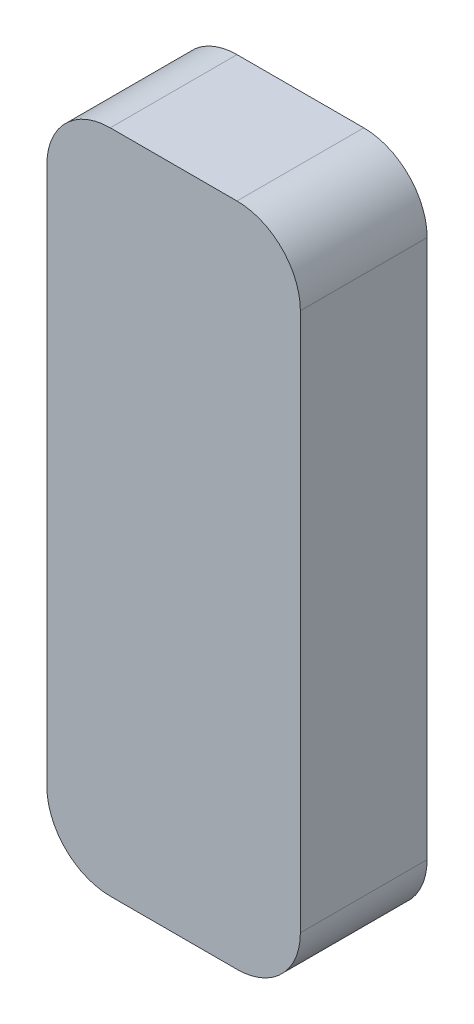
from build123d import *

# Parameters (mm, degrees)
EXTRUDE_1_DEPTH = 20


with BuildPart() as part:
    # 草图1 → 凸台-拉伸1 (new body)
    with BuildSketch(Plane.XY):
        with BuildLine():
            Line((-10, -52.5), (10, -52.5))
            ThreePointArc((10, -52.5), (17.071067812, -49.571067812), (20, -42.5))
            Line((20, -42.5), (20, 42.5))
            ThreePointArc((20, 42.5), (17.071067812, 49.571067812), (10, 52.5))
            Line((10, 52.5), (-10, 52.5))
            ThreePointArc((-10, 52.5), (-17.071067812, 49.571067812), (-20, 42.5))
            Line((-20, 42.5), (-20, -42.5))
            ThreePointArc((-20, -42.5), (-17.071067812, -49.571067812), (-10, -52.5))
        make_face()
    extrude(amount=EXTRUDE_1_DEPTH)


solid = part.part
